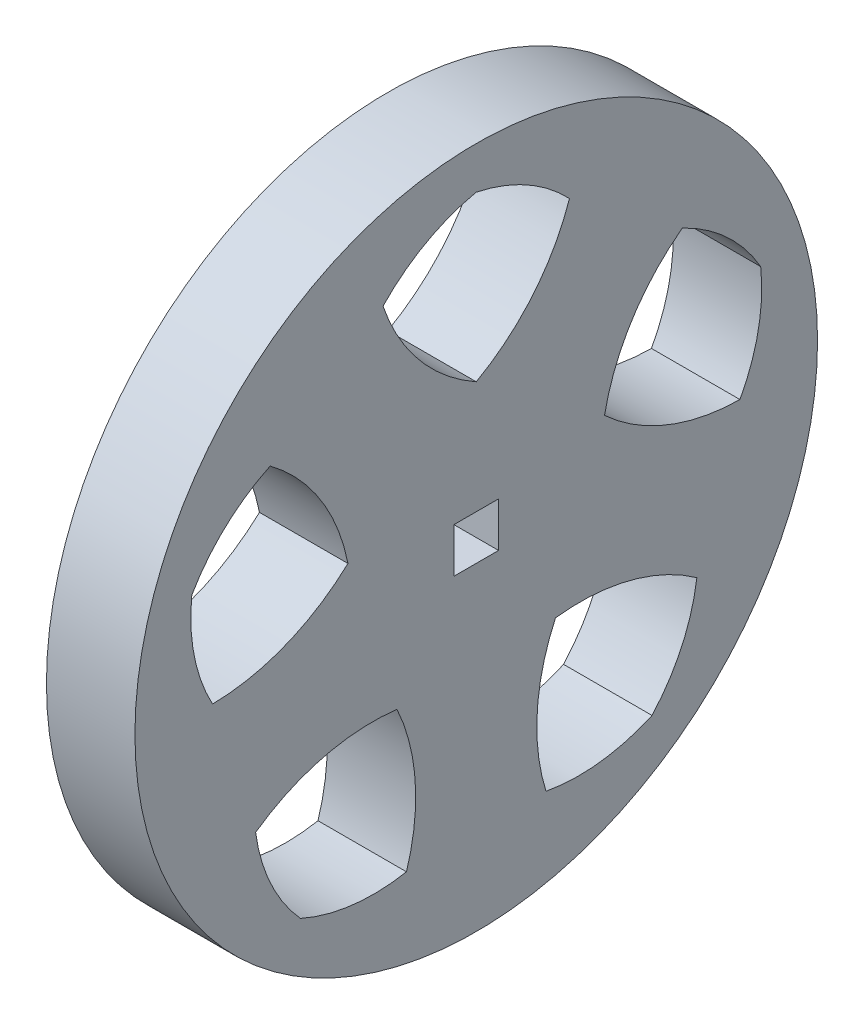
from build123d import *

# Parameters (mm, degrees)
SKETCH1_R           = 13.5
BOSS_EXTRUDE1_DEPTH = 3.5
CUT_EXTRUDE1_REACH  = 21.41
CIRPATTERN1_COUNT   = 5
CUT_EXTRUDE2_REACH  = 21.41
SKETCH3_W           = 1.767766952
SKETCH3_H           = 1.767766952


with BuildPart() as part:
    # Sketch1 → Boss-Extrude1 (new body)
    with BuildSketch(Plane(origin=(0, 0, 0), x_dir=(0, 0, -1), z_dir=(1, 0, 0))):
        Circle(SKETCH1_R)
    extrude(amount=BOSS_EXTRUDE1_DEPTH)

    # Sketch2 → Cut-Extrude1 (cut, up to next)
    with BuildSketch(Plane(origin=(0, 0, 0), x_dir=(0, 0, -1), z_dir=(1, 0, 0)), mode=Mode.PRIVATE) as cut_extrude1_sk1:
        with BuildLine():
            ThreePointArc((0, 5.335224169), (-2.256377168, 7.208861271), (-3.687303072, 9.768979428))
            ThreePointArc((-3.687303072, 9.768979428), (-2.000654027, 11.080188439), (0, 11.829479796))
            ThreePointArc((0, 11.829479796), (2.000654027, 11.080188439), (3.687303072, 9.768979428))
            ThreePointArc((3.687303072, 9.768979428), (2.256377168, 7.208861271), (0, 5.335224169))
        make_face()
    cut_extrude1_tool1 = extrude(cut_extrude1_sk1.sketch, amount=CUT_EXTRUDE1_REACH, mode=Mode.PRIVATE) & part.part
    cut_extrude1 = cut_extrude1_tool1.solids().sort_by_distance((0, 8.878443, 0))[0]
    add(cut_extrude1, mode=Mode.SUBTRACT)

    # CirPattern1: Cut-Extrude1 ×5 about axis
    cirpattern1_axis = Axis((0, 0, 0), (1, 0, 0))
    for i in range(1, CIRPATTERN1_COUNT):
        add(cut_extrude1.rotate(cirpattern1_axis, i * 360 / CIRPATTERN1_COUNT), mode=Mode.SUBTRACT)

    # Sketch3 → Cut-Extrude2 (cut, up to next)
    with BuildSketch(Plane(origin=(0, 0, 0), x_dir=(0, 0, -1), z_dir=(1, 0, 0)), mode=Mode.PRIVATE) as cut_extrude2_sk1:
        Rectangle(SKETCH3_W, SKETCH3_H)
    cut_extrude2_tool1 = extrude(cut_extrude2_sk1.sketch, amount=CUT_EXTRUDE2_REACH, mode=Mode.PRIVATE) & part.part
    add(cut_extrude2_tool1.solids().sort_by_distance((0, 0, 0))[0], mode=Mode.SUBTRACT)


solid = part.part
